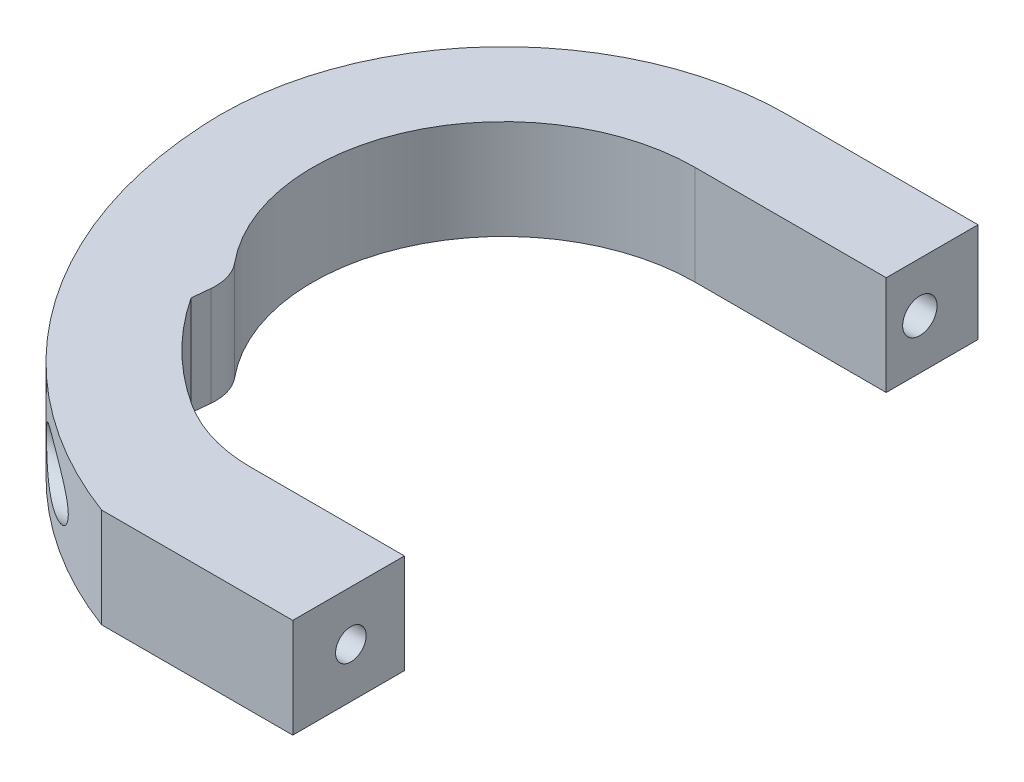
from build123d import *

# Parameters (mm, degrees)
SKETCH1_R               = 18.5
SKETCH1_R_2             = 12.5
BOSS_EXTRUDE1_DEPTH     = 6.5
SKETCH2_R               = 46.70286463
CUT_EXTRUDE1_DEPTH      = 27.958301133
CUT_EXTRUDE2_DEPTH      = 27.958301133
CUT_EXTRUDE2_DEPTH_BACK = 27.958301133
SKETCH3_R               = 1.125
SKETCH4_R               = 1.9
CUT_EXTRUDE3_DEPTH      = 23.989128026
BOSS_EXTRUDE2_START     = 12.5
SKETCH6_W               = 6
SKETCH6_H               = 6.5
SKETCH6_R               = 1.125
BOSS_EXTRUDE2_DEPTH     = 12.5
CUT_EXTRUDE4_START      = -12.5
SKETCH7_R               = 1.9
CUT_EXTRUDE4_DEPTH      = 12.5
BOSS_EXTRUDE3_DEPTH     = 6.5
CUT_EXTRUDE7_DEPTH      = 12.5
FILLET2_R               = 3
SKETCH14_R              = 1
CUT_EXTRUDE9_DEPTH      = 33.805335008
BOSS_EXTRUDE4_START     = 12.5
SKETCH15_W              = 7.3
SKETCH15_H              = 6.5
SKETCH15_R              = 1
BOSS_EXTRUDE4_DEPTH     = 12.5
FILLET3_R               = 10
SKETCH16_R              = 1.9
CUT_EXTRUDE11_DEPTH     = 37.526565832


with BuildPart() as part:
    # Sketch1 → Boss-Extrude1 (new body)
    with BuildSketch(Plane(origin=(0, 0, 0), x_dir=(1, 0, 0), z_dir=(0, 1, 0))):
        with Locations(Location((0, 0, 0), (0, 0, 90))):
            Circle(SKETCH1_R)
        with Locations(Location((0, 0, 0), (0, 0, 90))):
            Circle(SKETCH1_R_2, mode=Mode.SUBTRACT)
    extrude(amount=BOSS_EXTRUDE1_DEPTH)

    # Sketch2 → Cut-Extrude1 (cut, through all)
    with BuildSketch(Plane(origin=(0, 0, 0), x_dir=(0, 0, -1), z_dir=(1, 0, 0))):
        Circle(SKETCH2_R)
    extrude(amount=CUT_EXTRUDE1_DEPTH, mode=Mode.SUBTRACT)

    # Sketch3 → Cut-Extrude2 (cut, two sides: drawn at the far end of the back side and taken through both)
    with BuildSketch(Plane(origin=(0, 0, 0), x_dir=(0, 0, -1), z_dir=(1, 0, 0)).offset(-CUT_EXTRUDE2_DEPTH_BACK)):
        with Locations((14.7, 3.25)):
            Circle(SKETCH3_R)
    extrude(amount=CUT_EXTRUDE2_DEPTH + CUT_EXTRUDE2_DEPTH_BACK, mode=Mode.SUBTRACT)

    # Sketch4 → Cut-Extrude3 (cut, through all)
    with BuildSketch(Plane(origin=(-6.5, 0, 0), x_dir=(0, 0, -1), z_dir=(1, 0, 0))):
        with Locations((14.7, 3.25)):
            Circle(SKETCH4_R)
    extrude(amount=-CUT_EXTRUDE3_DEPTH, mode=Mode.SUBTRACT)

    # Sketch6 → Boss-Extrude2 (add)
    with BuildSketch(Plane(origin=(0, 0, 0), x_dir=(0, 0, -1), z_dir=(1, 0, 0)).offset(BOSS_EXTRUDE2_START)):
        with Locations((15.5, 3.25)):
            Rectangle(SKETCH6_W, SKETCH6_H)
        with Locations((14.7, 3.25)):
            Circle(SKETCH6_R, mode=Mode.SUBTRACT)
    extrude(amount=-BOSS_EXTRUDE2_DEPTH)

    # Sketch7 → Cut-Extrude4 (cut)
    with BuildSketch(Plane.ZY.offset(6.5).offset(CUT_EXTRUDE4_START)):
        with Locations(Location((-14.7, 3.25, 0), (0, 0, 180))):
            Circle(SKETCH7_R)
    extrude(amount=CUT_EXTRUDE4_DEPTH, mode=Mode.SUBTRACT)

    # Sketch11 → Boss-Extrude3 (add)
    with BuildSketch(Plane(origin=(0, 0, 0), x_dir=(1, 0, 0), z_dir=(0, 1, 0))):
        with BuildLine():
            Line((0, -18.5), (0, -26.3))
            ThreePointArc((0, -26.3), (-13.323632383, -16.015482855), (-18.5, 0))
            ThreePointArc((-18.5, 0), (-13.015505379, -13.015505379), (0, -18.5))
        make_face()
    extrude(amount=BOSS_EXTRUDE3_DEPTH)

    # Sketch13 → Cut-Extrude7 (cut)
    with BuildSketch(Plane(origin=(0, 0, 0), x_dir=(-1, 0, 0), z_dir=(0, -1, 0))):
        with BuildLine():
            ThreePointArc((8.831682782, -8.845980965), (4.778872144, -11.550427742), (0, -12.5))
            Line((0, -12.5), (0, -19))
            ThreePointArc((0, -19), (5.098309427, -15.844292422), (9.082430599, -11.363441184))
            Line((9.082430599, -11.363441184), (8.831682782, -8.845980965))
        make_face()
    extrude(amount=-CUT_EXTRUDE7_DEPTH, mode=Mode.SUBTRACT)

    # Fillet2
    fillet2_edges = [part.edges().sort_by_distance(p)[0] for p in [
        (-8.831682782, 3.25, 8.845980965),
    ]]
    fillet(fillet2_edges, radius=FILLET2_R)

    # Sketch14 → Cut-Extrude9 (cut, through all)
    with BuildSketch(Plane(origin=(0, 0, 0), x_dir=(0, 0, -1), z_dir=(1, 0, 0))):
        with Locations((-22.5, 3.25)):
            Circle(SKETCH14_R)
    extrude(amount=-CUT_EXTRUDE9_DEPTH, mode=Mode.SUBTRACT)

    # Sketch15 → Boss-Extrude4 (add)
    with BuildSketch(Plane(origin=(0, 0, 0), x_dir=(0, 0, -1), z_dir=(1, 0, 0)).offset(BOSS_EXTRUDE4_START)):
        with Locations((-22.65, 3.25)):
            Rectangle(SKETCH15_W, SKETCH15_H)
        with Locations((-22.5, 3.25)):
            Circle(SKETCH15_R, mode=Mode.SUBTRACT)
    extrude(amount=-BOSS_EXTRUDE4_DEPTH)

    # Fillet3
    fillet3_edges = [part.edges().sort_by_distance(p)[0] for p in [
        (0, 3.25, 19),
    ]]
    fillet(fillet3_edges, radius=FILLET3_R)

    # Sketch16 → Cut-Extrude11 (cut, through all)
    with BuildSketch(Plane(origin=(6, 0, 0), x_dir=(0, 0, -1), z_dir=(1, 0, 0))):
        with Locations((-22.5, 3.25)):
            Circle(SKETCH16_R)
    extrude(amount=-CUT_EXTRUDE11_DEPTH, mode=Mode.SUBTRACT)


solid = part.part
